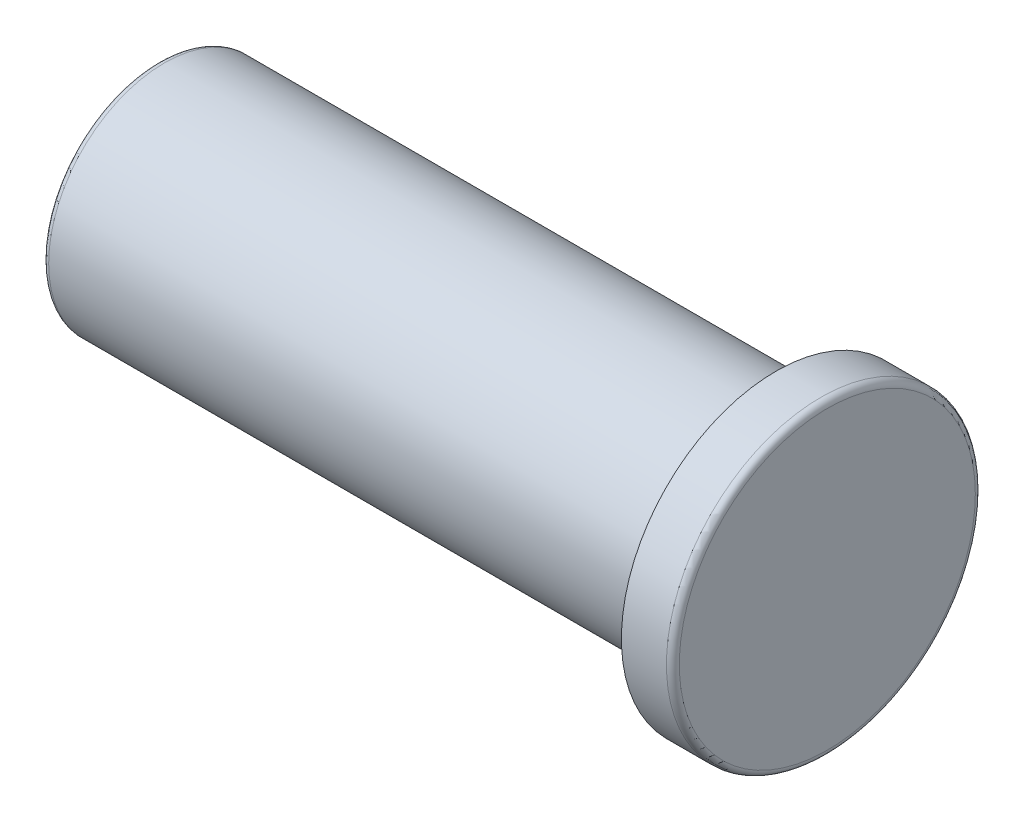
from build123d import *

# Parameters (mm, degrees)
SKETCH_1_R      = 9
EXTRUDE_1_DEPTH = 48
SKETCH_2_R      = 12
EXTRUDE_2_DEPTH = 4
FILLET_1_R      = 0.5
FILLET_2_R      = 0.5


with BuildPart() as part:
    # 草图1 → 凸台-拉伸1 (new body)
    with BuildSketch(Plane(origin=(0, 0, 0), x_dir=(0, 0, -1), z_dir=(1, 0, 0))):
        Circle(SKETCH_1_R)
    extrude(amount=-EXTRUDE_1_DEPTH)

    # 草图2 → 凸台-拉伸2 (add)
    with BuildSketch(Plane(origin=(0, 0, 0), x_dir=(0, 0, -1), z_dir=(1, 0, 0))):
        Circle(SKETCH_2_R)
    extrude(amount=EXTRUDE_2_DEPTH)

    # 圆角1
    fillet_1_edges = [part.edges().sort_by_distance(p)[0] for p in [
        (4, 0, 12),
    ]]
    fillet(fillet_1_edges, radius=FILLET_1_R)

    # 圆角2
    fillet_2_edges = [part.edges().sort_by_distance(p)[0] for p in [
        (-48, 0, 9),
    ]]
    fillet(fillet_2_edges, radius=FILLET_2_R)


solid = part.part
